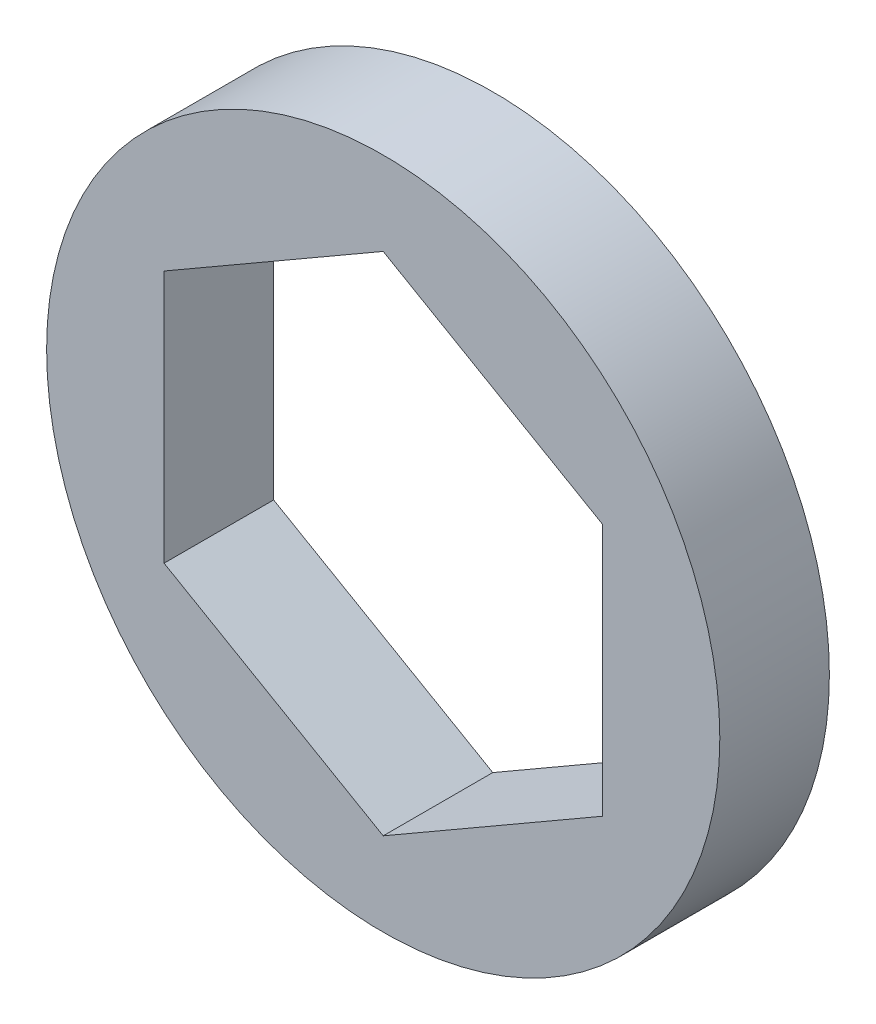
from build123d import *

# Parameters (mm, degrees)
SKETCH1_R         = 9.7536
SPACER_BOSS_DEPTH = 3.175


with BuildPart() as part:
    # Sketch1 → Spacer Boss (new body)
    with BuildSketch(Plane.XY):
        Circle(SKETCH1_R)
        Polygon((-6.35, 3.666174209), (-6.35, -3.666174209), (0, -7.332348419), (6.35, -3.666174209), (6.35, 3.666174209), (0, 7.332348419), align=None, mode=Mode.SUBTRACT)
    extrude(amount=SPACER_BOSS_DEPTH)


solid = part.part
